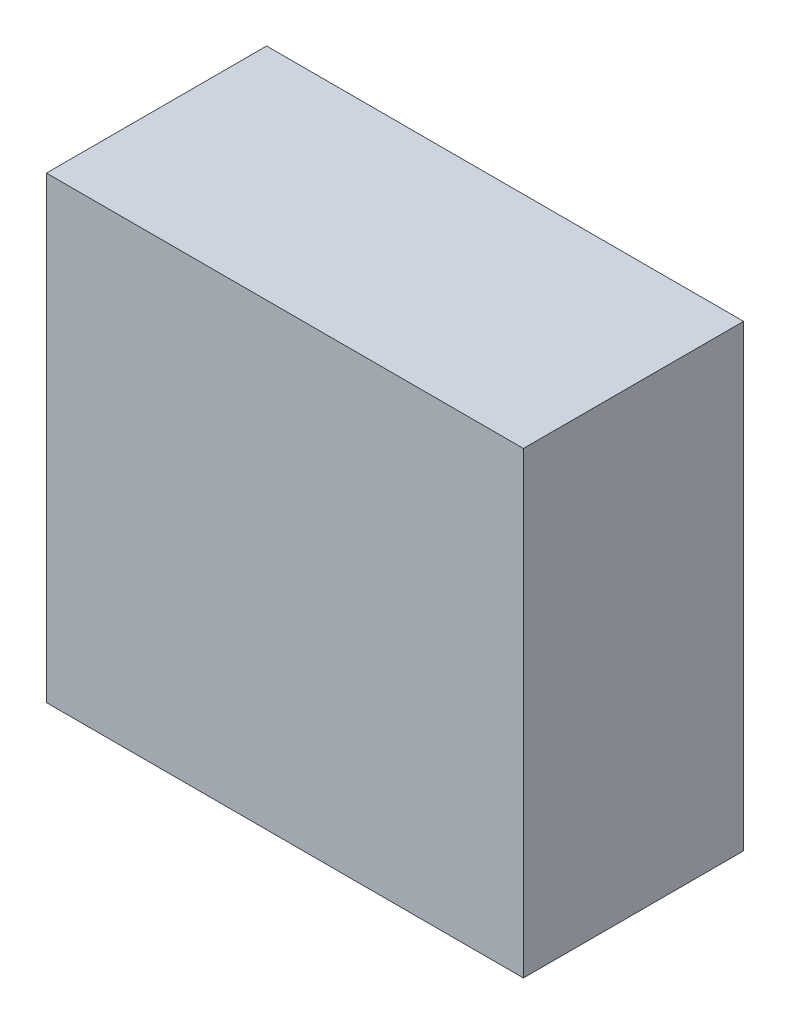
from build123d import *

# Parameters (mm, degrees)
STORE_PANO_GUC_KAYNAGI_24V_10A_1_START = -640
SKETCH1_W                              = 130
SKETCH1_H                              = 125
STORE_PANO_GUC_KAYNAGI_24V_10A_1_DEPTH = 60


with BuildPart() as part:
    # Sketch1 → STORE_pano_guc_kaynagi_24V_10A_1 (new body)
    with BuildSketch(Plane.XY.offset(STORE_PANO_GUC_KAYNAGI_24V_10A_1_START)):
        with Locations((765, 1752.5)):
            Rectangle(SKETCH1_W, SKETCH1_H)
    extrude(amount=-STORE_PANO_GUC_KAYNAGI_24V_10A_1_DEPTH)


solid = part.part
